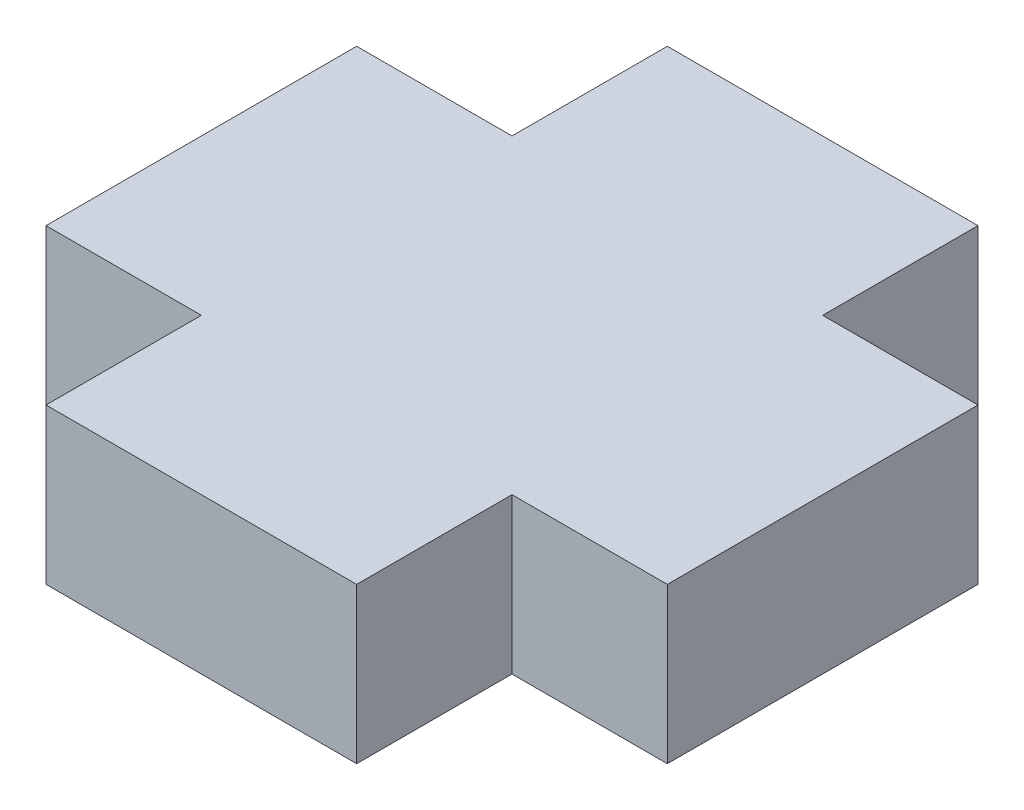
from build123d import *

# Parameters (mm, degrees)
EXTRUDE_1_DEPTH = 5


with BuildPart() as part:
    # 草图1 → 凸台-拉伸1 (new body)
    with BuildSketch(Plane(origin=(0, 0, 0), x_dir=(1, 0, 0), z_dir=(0, 1, 0))):
        Polygon((15, 10), (20, 10), (20, 0), (15, 0), (15, -5), (5, -5), (5, 0), (0, 0), (0, 10), (5, 10), (5, 15), (15, 15), align=None)
    extrude(amount=EXTRUDE_1_DEPTH)


solid = part.part
